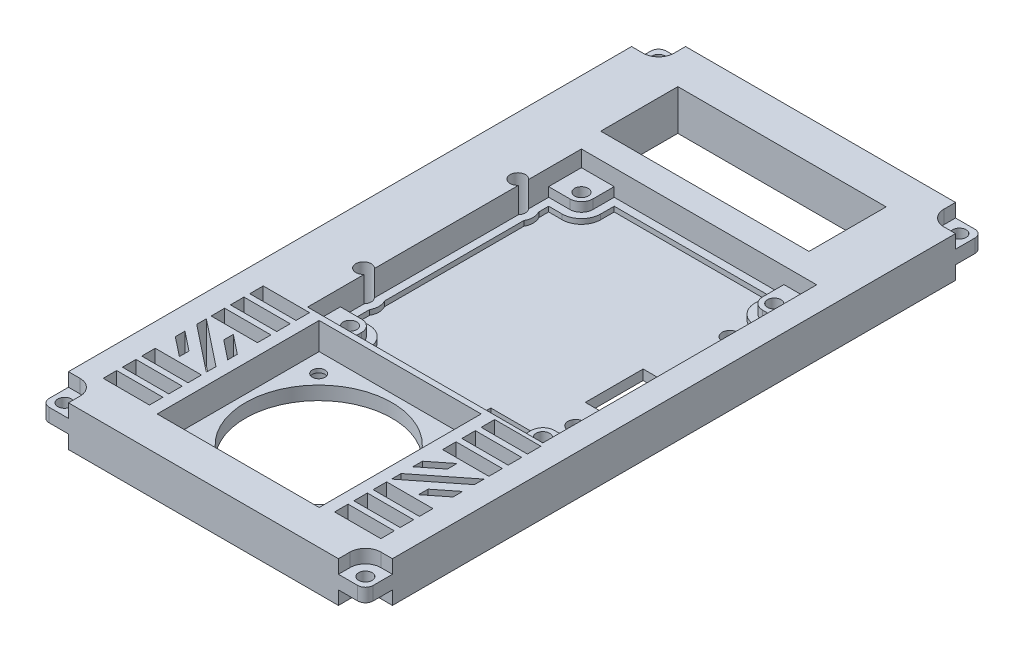
from build123d import *

# Parameters (mm, degrees)
SKETCH_1_W            = 84
SKETCH_1_H            = 160
EXTRUDE_1_DEPTH       = 10.5
FILLET_1_R            = 2
SKETCH_2_W            = 12
SKETCH_2_H            = 3.5
CUT_EXTRUDE_1_DEPTH   = 182.014502181
SKETCH_4_R            = 19
SKETCH_4_R_2          = 1.65
CUT_EXTRUDE_2_DEPTH   = 182.014502181
SKETCH_6_W            = 10
SKETCH_6_H            = 15
SKETCH_6_W_2          = 12.5
SKETCH_6_H_2          = 6.5
CUT_EXTRUDE_3_DEPTH   = 182.014502181
SKETCH_7_R            = 2
CUT_EXTRUDE_4_DEPTH   = 182.014502181
SKETCH_8_R            = 1.75
CUT_EXTRUDE_5_DEPTH   = 182.014502181
CUT_EXTRUDE_6_DEPTH   = 3.5
CUT_EXTRUDE_START     = -7
CUT_EXTRUDE_8_DEPTH   = 3.5
SKETCH_10_R           = 3.5
SKETCH_10_R_2         = 3
CUT_EXTRUDE_7_DEPTH   = 2.5
SKETCH_8_4_W          = 42
SKETCH_8_4_H          = 42
CUT_EXTRUDE_9_DEPTH   = 7
SKETCH_8_5_W          = 61
SKETCH_8_5_H          = 71
CUT_EXTRUDE_10_DEPTH  = 6.5
EXTRUDE_START         = -4.2
SKETCH_8_6_R          = 3
SKETCH_8_6_R_2        = 1.75
EXTRUDE_2_DEPTH       = 2.3
EXTRUDE_START_2       = 2.3
EXTRUDE_3_DEPTH       = 2.3
CUT_EXTRUDE_1_2_DEPTH = 0.1
CUT_EXTRUDE_11_DEPTH  = 1.4
SKETCH_14_W           = 54
SKETCH_14_H           = 20
CUT_EXTRUDE_12_DEPTH  = 182.014502181


with BuildPart() as part:
    # 草图1 → 凸台-拉伸1 (new body)
    with BuildSketch(Plane(origin=(0, 0, 0), x_dir=(1, 0, 0), z_dir=(0, 1, 0))):
        with Locations((42, 80)):
            Rectangle(SKETCH_1_W, SKETCH_1_H)
    extrude(amount=EXTRUDE_1_DEPTH)

    # 圆角1
    fillet_1_edges = [part.edges().sort_by_distance(p)[0] for p in [
        (0, 5.25, -160),
        (84, 5.25, -160),
        (84, 5.25, 0),
        (0, 5.25, 0),
    ]]
    fillet(fillet_1_edges, radius=FILLET_1_R)

    # 草图2 → Cut-Extrude 1 (cut, through all)
    with BuildSketch(Plane(origin=(0, 10.5, 0), x_dir=(1, 0, 0), z_dir=(0, 1, 0))):
        Polygon((73, 27.25), (78, 31.208333333), (78, 28.708333333), (73, 24.75), align=None)
        Polygon((66, 24.75), (66, 27.25), (78, 36.75), (78, 34.25), align=None)
        Polygon((6, 28.708333333), (11, 24.75), (11, 27.25), (6, 31.208333333), align=None)
        Polygon((6, 36.75), (6, 34.25), (18, 24.75), (18, 27.25), align=None)
        Polygon((13, 36.75), (13, 34.25), (18, 30.291666667), (18, 32.791666667), align=None)
        Polygon((66, 30.291666667), (66, 32.791666667), (71, 36.75), (71, 34.25), align=None)
        with Locations((12, 39.75)):
            Rectangle(SKETCH_2_W, SKETCH_2_H)
        with Locations((12, 11.75)):
            Rectangle(SKETCH_2_W, SKETCH_2_H)
        with Locations((12, 16.75)):
            Rectangle(SKETCH_2_W, SKETCH_2_H)
        with Locations((12, 44.75)):
            Rectangle(SKETCH_2_W, SKETCH_2_H)
        with Locations((12, 21.75)):
            Rectangle(SKETCH_2_W, SKETCH_2_H)
        with Locations((12, 49.75)):
            Rectangle(SKETCH_2_W, SKETCH_2_H)
        with Locations((72, 11.75)):
            Rectangle(SKETCH_2_W, SKETCH_2_H)
        with Locations((72, 16.75)):
            Rectangle(SKETCH_2_W, SKETCH_2_H)
        with Locations((72, 21.75)):
            Rectangle(SKETCH_2_W, SKETCH_2_H)
        with Locations((72, 39.75)):
            Rectangle(SKETCH_2_W, SKETCH_2_H)
        with Locations((72, 44.75)):
            Rectangle(SKETCH_2_W, SKETCH_2_H)
        with Locations((72, 49.75)):
            Rectangle(SKETCH_2_W, SKETCH_2_H)
    extrude(amount=-CUT_EXTRUDE_1_DEPTH, mode=Mode.SUBTRACT)

    # 草图4 → 切除-拉伸2 (cut, through all)
    with BuildSketch(Plane(origin=(0, 10.5, 0), x_dir=(1, 0, 0), z_dir=(0, 1, 0))):
        with Locations(Location((41.880492977, 30, 0), (0, 0, 270))):
            Circle(SKETCH_4_R)
        with Locations(Location((57.880492977, 14, 0), (0, 0, 270))):
            Circle(SKETCH_4_R_2)
        with Locations(Location((57.880492977, 46, 0), (0, 0, 270))):
            Circle(SKETCH_4_R_2)
        with Locations(Location((25.880492977, 46, 0), (0, 0, 270))):
            Circle(SKETCH_4_R_2)
        with Locations(Location((25.880492977, 14, 0), (0, 0, 270))):
            Circle(SKETCH_4_R_2)
    extrude(amount=-CUT_EXTRUDE_2_DEPTH, mode=Mode.SUBTRACT)

    # 草图6 → 切除-拉伸3 (cut, through all)
    with BuildSketch(Plane(origin=(0, 10.5, 0), x_dir=(1, 0, 0), z_dir=(0, 1, 0))):
        with Locations((71, 82.5)):
            Rectangle(SKETCH_6_W, SKETCH_6_H)
        with Locations((61.25, 58.25)):
            Rectangle(SKETCH_6_W_2, SKETCH_6_H_2)
    extrude(amount=-CUT_EXTRUDE_3_DEPTH, mode=Mode.SUBTRACT)

    # 草图7 → 切除-拉伸4 (cut, through all)
    with BuildSketch(Plane(origin=(0, 10.5, 0), x_dir=(1, 0, 0), z_dir=(0, 1, 0))):
        with Locations(Location((15, 108.5, 0), (0, 0, 270))):
            Circle(SKETCH_7_R)
        with Locations(Location((70, 108.5, 0), (0, 0, 270))):
            Circle(SKETCH_7_R)
        with Locations(Location((15, 68.5, 0), (0, 0, 270))):
            Circle(SKETCH_7_R)
        with Locations(Location((70, 68.5, 0), (0, 0, 270))):
            Circle(SKETCH_7_R)
    extrude(amount=-CUT_EXTRUDE_4_DEPTH, mode=Mode.SUBTRACT)

    # 草图8 → 切除-拉伸5 (cut, through all)
    with BuildSketch(Plane(origin=(0, 10.5, 0), x_dir=(1, 0, 0), z_dir=(0, 1, 0))):
        with Locations(Location((3, 157, 0), (0, 0, 270))):
            Circle(SKETCH_8_R)
        with Locations(Location((81, 157, 0), (0, 0, 270))):
            Circle(SKETCH_8_R)
        with Locations(Location((72, 118, 0), (0, 0, 270))):
            Circle(SKETCH_8_R)
        with Locations(Location((22, 118, 0), (0, 0, 270))):
            Circle(SKETCH_8_R)
        with Locations(Location((22, 58, 0), (0, 0, 270))):
            Circle(SKETCH_8_R)
        with Locations(Location((72, 58, 0), (0, 0, 270))):
            Circle(SKETCH_8_R)
        with Locations(Location((81, 3, 0), (0, 0, 270))):
            Circle(SKETCH_8_R)
        with Locations(Location((3, 3, 0), (0, 0, 270))):
            Circle(SKETCH_8_R)
    extrude(amount=-CUT_EXTRUDE_5_DEPTH, mode=Mode.SUBTRACT)

    # 草图9 → 切除-拉伸6 (cut)
    with BuildSketch(Plane(origin=(0, 10.5, 0), x_dir=(1, 0, 0), z_dir=(0, 1, 0))):
        with BuildLine():
            Line((7, 160), (2, 160))
            ThreePointArc((2, 160), (0.585786438, 159.414213562), (0, 158))
            Line((0, 158), (0, 153))
            Line((0, 153), (3, 153))
            ThreePointArc((3, 153), (5.828427125, 154.171572875), (7, 157))
            Line((7, 157), (7, 160))
        make_face()
        with BuildLine():
            Line((84, 153), (84, 158))
            ThreePointArc((84, 158), (83.414213562, 159.414213562), (82, 160))
            Line((82, 160), (77, 160))
            Line((77, 160), (77, 157))
            ThreePointArc((77, 157), (78.171572875, 154.171572875), (81, 153))
            Line((81, 153), (84, 153))
        make_face()
        with BuildLine():
            Line((0, 7), (0, 2))
            ThreePointArc((0, 2), (0.585786438, 0.585786438), (2, 0))
            Line((2, 0), (7, 0))
            Line((7, 0), (7, 3))
            ThreePointArc((7, 3), (5.828427125, 5.828427125), (3, 7))
            Line((3, 7), (0, 7))
        make_face()
        with BuildLine():
            Line((77, 0), (82, 0))
            ThreePointArc((82, 0), (83.414213562, 0.585786438), (84, 2))
            Line((84, 2), (84, 7))
            Line((84, 7), (81, 7))
            ThreePointArc((81, 7), (78.171572875, 5.828427125), (77, 3))
            Line((77, 3), (77, 0))
        make_face()
    extrude(amount=-CUT_EXTRUDE_6_DEPTH, mode=Mode.SUBTRACT)

    # 草图9<2> → 切除-拉伸8 (cut)
    with BuildSketch(Plane(origin=(0, 10.5, 0), x_dir=(1, 0, 0), z_dir=(0, 1, 0)).offset(CUT_EXTRUDE_START)):
        with BuildLine():
            Line((7, 160), (2, 160))
            ThreePointArc((2, 160), (0.585786438, 159.414213562), (0, 158))
            Line((0, 158), (0, 153))
            Line((0, 153), (3, 153))
            ThreePointArc((3, 153), (5.828427125, 154.171572875), (7, 157))
            Line((7, 157), (7, 160))
        make_face()
        with BuildLine():
            Line((84, 153), (84, 158))
            ThreePointArc((84, 158), (83.414213562, 159.414213562), (82, 160))
            Line((82, 160), (77, 160))
            Line((77, 160), (77, 157))
            ThreePointArc((77, 157), (78.171572875, 154.171572875), (81, 153))
            Line((81, 153), (84, 153))
        make_face()
        with BuildLine():
            Line((0, 7), (0, 2))
            ThreePointArc((0, 2), (0.585786438, 0.585786438), (2, 0))
            Line((2, 0), (7, 0))
            Line((7, 0), (7, 3))
            ThreePointArc((7, 3), (5.828427125, 5.828427125), (3, 7))
            Line((3, 7), (0, 7))
        make_face()
        with BuildLine():
            Line((77, 0), (82, 0))
            ThreePointArc((82, 0), (83.414213562, 0.585786438), (84, 2))
            Line((84, 2), (84, 7))
            Line((84, 7), (81, 7))
            ThreePointArc((81, 7), (78.171572875, 5.828427125), (77, 3))
            Line((77, 3), (77, 0))
        make_face()
    extrude(amount=-CUT_EXTRUDE_8_DEPTH, mode=Mode.SUBTRACT)

    # 草图10 → 切除-拉伸7 (cut)
    with BuildSketch(Plane(origin=(0, 0, 0), x_dir=(-1, 0, 0), z_dir=(0, -1, 0))):
        with Locations(Location((-71.880492977, 118, 0), (0, 0, 90))):
            Circle(SKETCH_10_R)
        with Locations(Location((-21.880492977, 118, 0), (0, 0, 90))):
            Circle(SKETCH_10_R)
        with Locations(Location((-21.880492977, 58, 0), (0, 0, 90))):
            Circle(SKETCH_10_R)
        with Locations(Location((-71.880492977, 58, 0), (0, 0, 90))):
            Circle(SKETCH_10_R)
        with Locations(Location((-57.880492977, 14, 0), (0, 0, 90))):
            Circle(SKETCH_10_R_2)
        with Locations(Location((-25.880492977, 14, 0), (0, 0, 90))):
            Circle(SKETCH_10_R_2)
        with Locations(Location((-25.880492977, 46, 0), (0, 0, 90))):
            Circle(SKETCH_10_R_2)
        with Locations(Location((-57.880492977, 46, 0), (0, 0, 90))):
            Circle(SKETCH_10_R_2)
    extrude(amount=-CUT_EXTRUDE_7_DEPTH, mode=Mode.SUBTRACT)

    # 草图8<4> → 切除-拉伸9 (cut)
    with BuildSketch(Plane(origin=(0, 10.5, 0), x_dir=(1, 0, 0), z_dir=(0, 1, 0))):
        with Locations((42, 30)):
            Rectangle(SKETCH_8_4_W, SKETCH_8_4_H)
    extrude(amount=-CUT_EXTRUDE_9_DEPTH, mode=Mode.SUBTRACT)

    # 草图8<5> → 切除-拉伸10 (cut)
    with BuildSketch(Plane(origin=(0, 10.5, 0), x_dir=(1, 0, 0), z_dir=(0, 1, 0))):
        with Locations((47, 88)):
            Rectangle(SKETCH_8_5_W, SKETCH_8_5_H)
    extrude(amount=-CUT_EXTRUDE_10_DEPTH, mode=Mode.SUBTRACT)

    # 草图8<6> → 凸台-拉伸2 (add)
    # profile 1 of 4: a face of its own
    with BuildSketch(Plane(origin=(0, 10.5, 0), x_dir=(1, 0, 0), z_dir=(0, 1, 0)).offset(EXTRUDE_START)):
        with Locations(Location((22, 118, 0), (0, 0, 270))):
            Circle(SKETCH_8_6_R)
        with Locations(Location((22, 118, 0), (0, 0, 270))):
            Circle(SKETCH_8_6_R_2, mode=Mode.SUBTRACT)
    # profile 2 of 4: a face of its own
    with BuildSketch(Plane(origin=(0, 10.5, 0), x_dir=(1, 0, 0), z_dir=(0, 1, 0)).offset(EXTRUDE_START)):
        with Locations(Location((72, 118, 0), (0, 0, 270))):
            Circle(SKETCH_8_6_R)
        with Locations(Location((72, 118, 0), (0, 0, 270))):
            Circle(SKETCH_8_6_R_2, mode=Mode.SUBTRACT)
    # profile 3 of 4: a face of its own
    with BuildSketch(Plane(origin=(0, 10.5, 0), x_dir=(1, 0, 0), z_dir=(0, 1, 0)).offset(EXTRUDE_START)):
        with Locations(Location((72, 58, 0), (0, 0, 270))):
            Circle(SKETCH_8_6_R)
        with Locations(Location((72, 58, 0), (0, 0, 270))):
            Circle(SKETCH_8_6_R_2, mode=Mode.SUBTRACT)
    # profile 4 of 4: a face of its own
    with BuildSketch(Plane(origin=(0, 10.5, 0), x_dir=(1, 0, 0), z_dir=(0, 1, 0)).offset(EXTRUDE_START)):
        with Locations(Location((22, 58, 0), (0, 0, 270))):
            Circle(SKETCH_8_6_R)
        with Locations(Location((22, 58, 0), (0, 0, 270))):
            Circle(SKETCH_8_6_R_2, mode=Mode.SUBTRACT)
    extrude(amount=-EXTRUDE_2_DEPTH)

    # 草图11 → 凸台-拉伸3 (add)
    with BuildSketch(Plane(origin=(0, 4, 0), x_dir=(1, 0, 0), z_dir=(0, 1, 0)).offset(EXTRUDE_START_2)):
        with BuildLine():
            Line((16.5, 115), (22, 115))
            ThreePointArc((22, 115), (19.878679656, 120.121320344), (25, 118))
            Line((25, 118), (25, 123.5))
            Line((25, 123.5), (16.5, 123.5))
            Line((16.5, 123.5), (16.5, 115))
        make_face()
        with BuildLine():
            Line((77.5, 123.5), (69, 123.5))
            Line((69, 123.5), (69, 118))
            ThreePointArc((69, 118), (72, 121), (75, 118))
            ThreePointArc((75, 118), (74.121320344, 115.878679656), (72, 115))
            Line((72, 115), (77.5, 115))
            Line((77.5, 115), (77.5, 123.5))
        make_face()
        with BuildLine():
            Line((77.5, 52.5), (77.5, 61))
            Line((77.5, 61), (72, 61))
            ThreePointArc((72, 61), (74.121320344, 60.121320344), (75, 58))
            ThreePointArc((75, 58), (72, 55), (69, 58))
            Line((69, 58), (69, 52.5))
            Line((69, 52.5), (77.5, 52.5))
        make_face()
        with BuildLine():
            Line((16.5, 52.5), (25, 52.5))
            Line((25, 52.5), (25, 58))
            ThreePointArc((25, 58), (19.878679656, 55.878679656), (22, 61))
            Line((22, 61), (16.5, 61))
            Line((16.5, 61), (16.5, 52.5))
        make_face()
    extrude(amount=-EXTRUDE_3_DEPTH)

    # 草图12 → Cut-Extrude 1 2 (cut)
    with BuildSketch(Plane(origin=(0, 4, 0), x_dir=(1, 0, 0), z_dir=(0, 1, 0))):
        with BuildLine():
            Line((22, 115), (16.5, 115))
            Line((16.5, 115), (16.5, 109.822875656))
            ThreePointArc((16.5, 109.822875656), (17, 108.5), (16.5, 107.177124344))
            Line((16.5, 107.177124344), (16.5, 69.822875656))
            ThreePointArc((16.5, 69.822875656), (17, 68.5), (16.5, 67.177124344))
            Line((16.5, 67.177124344), (16.5, 61))
            Line((16.5, 61), (22, 61))
            ThreePointArc((22, 61), (24.121320344, 60.121320344), (25, 58))
            Line((25, 58), (25, 52.5))
            Line((25, 52.5), (69, 52.5))
            Line((69, 52.5), (69, 58))
            ThreePointArc((69, 58), (69.878679656, 60.121320344), (72, 61))
            Line((72, 61), (77.5, 61))
            Line((77.5, 61), (77.5, 115))
            Line((77.5, 115), (72, 115))
            ThreePointArc((72, 115), (69.878679656, 115.878679656), (69, 118))
            Line((69, 118), (69, 123.5))
            Line((69, 123.5), (25, 123.5))
            Line((25, 123.5), (25, 118))
            ThreePointArc((25, 118), (24.121320344, 115.878679656), (22, 115))
        make_face()
        with BuildLine():
            Line((22, 113), (18.5, 113))
            Line((18.5, 113), (18.5, 110.436491673))
            ThreePointArc((18.5, 110.436491673), (19, 108.5), (18.5, 106.563508327))
            Line((18.5, 106.563508327), (18.5, 70.436491673))
            ThreePointArc((18.5, 70.436491673), (19, 68.5), (18.5, 66.563508327))
            Line((18.5, 66.563508327), (18.5, 63))
            Line((18.5, 63), (22, 63))
            ThreePointArc((22, 63), (25.535533906, 61.535533906), (27, 58))
            Line((27, 58), (27, 54.5))
            Line((27, 54.5), (67, 54.5))
            Line((67, 54.5), (67, 58))
            ThreePointArc((67, 58), (68.464466094, 61.535533906), (72, 63))
            Line((72, 63), (75.5, 63))
            Line((75.5, 63), (75.5, 113))
            Line((75.5, 113), (72, 113))
            ThreePointArc((72, 113), (68.464466094, 114.464466094), (67, 118))
            Line((67, 118), (67, 121.5))
            Line((67, 121.5), (27, 121.5))
            Line((27, 121.5), (27, 118))
            ThreePointArc((27, 118), (25.535533906, 114.464466094), (22, 113))
        make_face(mode=Mode.SUBTRACT)
    extrude(amount=-CUT_EXTRUDE_1_2_DEPTH, mode=Mode.SUBTRACT)

    # 草图13 → 切除-拉伸11 (cut)
    with BuildSketch(Plane(origin=(0, 4, 0), x_dir=(1, 0, 0), z_dir=(0, 1, 0))):
        with BuildLine():
            Line((72, 63), (75.5, 63))
            Line((75.5, 63), (75.5, 75))
            Line((75.5, 75), (66, 75))
            Line((66, 75), (66, 90))
            Line((66, 90), (75.5, 90))
            Line((75.5, 90), (75.5, 113))
            Line((75.5, 113), (72, 113))
            ThreePointArc((72, 113), (68.464466094, 114.464466094), (67, 118))
            Line((67, 118), (67, 121.5))
            Line((67, 121.5), (27, 121.5))
            Line((27, 121.5), (27, 118))
            ThreePointArc((27, 118), (25.535533906, 114.464466094), (22, 113))
            Line((22, 113), (18.5, 113))
            Line((18.5, 113), (18.5, 110.436491673))
            ThreePointArc((18.5, 110.436491673), (19, 108.5), (18.5, 106.563508327))
            Line((18.5, 106.563508327), (18.5, 70.436491673))
            ThreePointArc((18.5, 70.436491673), (19, 68.5), (18.5, 66.563508327))
            Line((18.5, 66.563508327), (18.5, 63))
            Line((18.5, 63), (22, 63))
            ThreePointArc((22, 63), (25.535533906, 61.535533906), (27, 58))
            Line((27, 58), (27, 54.5))
            Line((27, 54.5), (67, 54.5))
            Line((67, 54.5), (67, 55))
            Line((67, 55), (55, 55))
            Line((55, 55), (55, 61.5))
            Line((55, 61.5), (67.5, 61.5))
            Line((67.5, 61.5), (67.5, 60.179449472))
            ThreePointArc((67.5, 60.179449472), (69.344557227, 62.236581603), (72, 63))
        make_face()
    extrude(amount=-CUT_EXTRUDE_11_DEPTH, mode=Mode.SUBTRACT)

    # 草图14 → 切除-拉伸12 (cut, through all)
    with BuildSketch(Plane(origin=(0, 10.5, 0), x_dir=(1, 0, 0), z_dir=(0, 1, 0))):
        with Locations((42, 140)):
            Rectangle(SKETCH_14_W, SKETCH_14_H)
    extrude(amount=-CUT_EXTRUDE_12_DEPTH, mode=Mode.SUBTRACT)


solid = part.part
